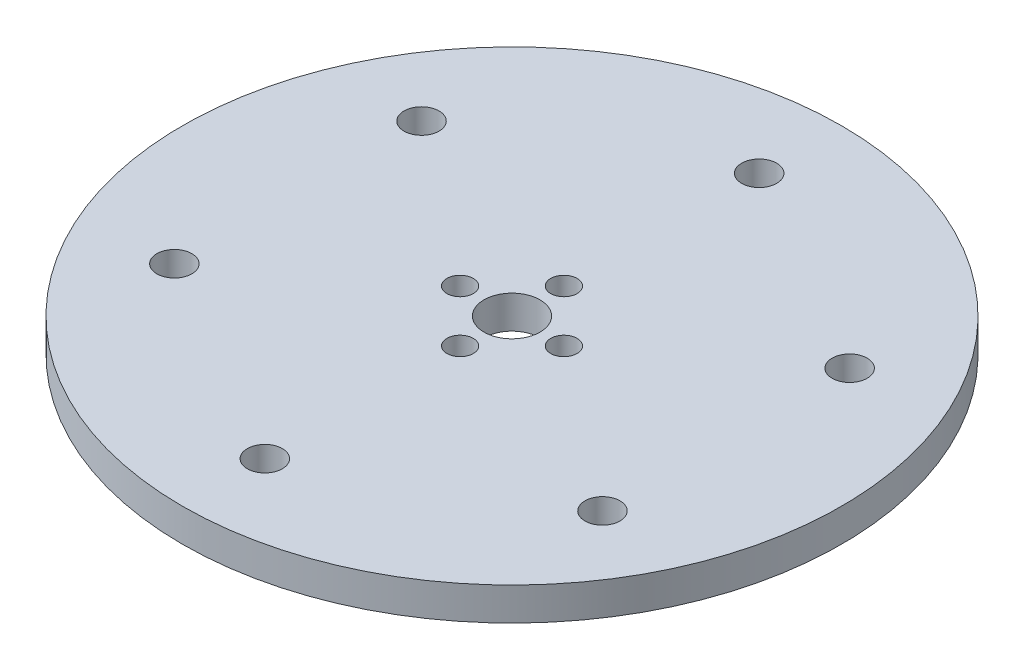
from build123d import *

# Parameters (mm, degrees)
SKETCH1_R           = 50.8
BOSS_EXTRUDE1_DEPTH = 5.08
SKETCH2_R           = 2.69875
CUT_EXTRUDE1_DEPTH  = 5.08
SKETCH3_R           = 4.318
SKETCH3_R_2         = 2.032
CUT_EXTRUDE2_DEPTH  = 5.08


with BuildPart() as part:
    # Sketch1 → Boss-Extrude1 (new body)
    with BuildSketch(Plane(origin=(0, 0, 0), x_dir=(1, 0, 0), z_dir=(0, 1, 0))):
        with Locations(Location((0, 0, 0), (0, 0, 270))):
            Circle(SKETCH1_R)
    extrude(amount=BOSS_EXTRUDE1_DEPTH)

    # Sketch2 → Cut-Extrude1 (cut)
    with BuildSketch(Plane(origin=(0, 5.08, 0), x_dir=(1, 0, 0), z_dir=(0, 1, 0))):
        with Locations(Location((0, -38.1, 0), (0, 0, 270))):
            Circle(SKETCH2_R)
        with Locations(Location((-32.995567884, -19.05, 0), (0, 0, 270))):
            Circle(SKETCH2_R)
        with Locations(Location((-32.995567884, 19.05, 0), (0, 0, 270))):
            Circle(SKETCH2_R)
        with Locations(Location((0, 38.1, 0), (0, 0, 270))):
            Circle(SKETCH2_R)
        with Locations(Location((32.995567884, 19.05, 0), (0, 0, 270))):
            Circle(SKETCH2_R)
        with Locations(Location((32.995567884, -19.05, 0), (0, 0, 270))):
            Circle(SKETCH2_R)
    extrude(amount=-CUT_EXTRUDE1_DEPTH, mode=Mode.SUBTRACT)

    # Sketch3 → Cut-Extrude2 (cut)
    with BuildSketch(Plane.XZ):
        with Locations(Location((0, 0, 0), (0, 0, 270))):
            Circle(SKETCH3_R)
        with Locations(Location((0, -8.001, 0), (0, 0, 270))):
            Circle(SKETCH3_R_2)
        with Locations(Location((-8.001, 0, 0), (0, 0, 270))):
            Circle(SKETCH3_R_2)
        with Locations(Location((0, 8.001, 0), (0, 0, 270))):
            Circle(SKETCH3_R_2)
        with Locations(Location((8.001, 0, 0), (0, 0, 270))):
            Circle(SKETCH3_R_2)
    extrude(amount=-CUT_EXTRUDE2_DEPTH, mode=Mode.SUBTRACT)


solid = part.part
